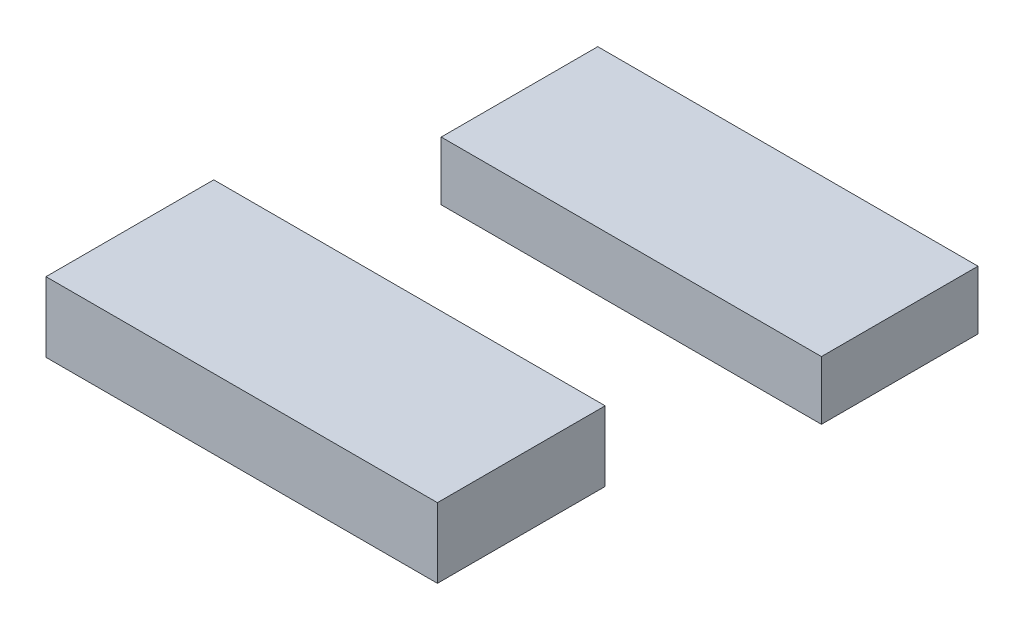
from build123d import *

# Parameters (mm, degrees)
SKETCH1_W           = 14
SKETCH1_H           = 6
BOSS_EXTRUDE1_DEPTH = 2.5
SKETCH2_W           = 13.6
SKETCH2_H           = 5.6
BOSS_EXTRUDE2_DEPTH = 2.1


with BuildPart() as part:
    # Sketch1 → Boss-Extrude1 (new body)
    with BuildSketch(Plane(origin=(0, 0, 0), x_dir=(1, 0, 0), z_dir=(0, 1, 0))):
        with Locations((-16.628676861, 10.978601777)):
            Rectangle(SKETCH1_W, SKETCH1_H)
    extrude(amount=BOSS_EXTRUDE1_DEPTH)


with BuildPart() as body_2:
    # Sketch2 → Boss-Extrude2 (new body)
    with BuildSketch(Plane(origin=(0, 0, 0), x_dir=(1, 0, 0), z_dir=(0, 1, 0))):
        with Locations((-14.485869504, 22.571343525)):
            Rectangle(SKETCH2_W, SKETCH2_H)
    extrude(amount=BOSS_EXTRUDE2_DEPTH)


solid = Compound([part.part, body_2.part])
